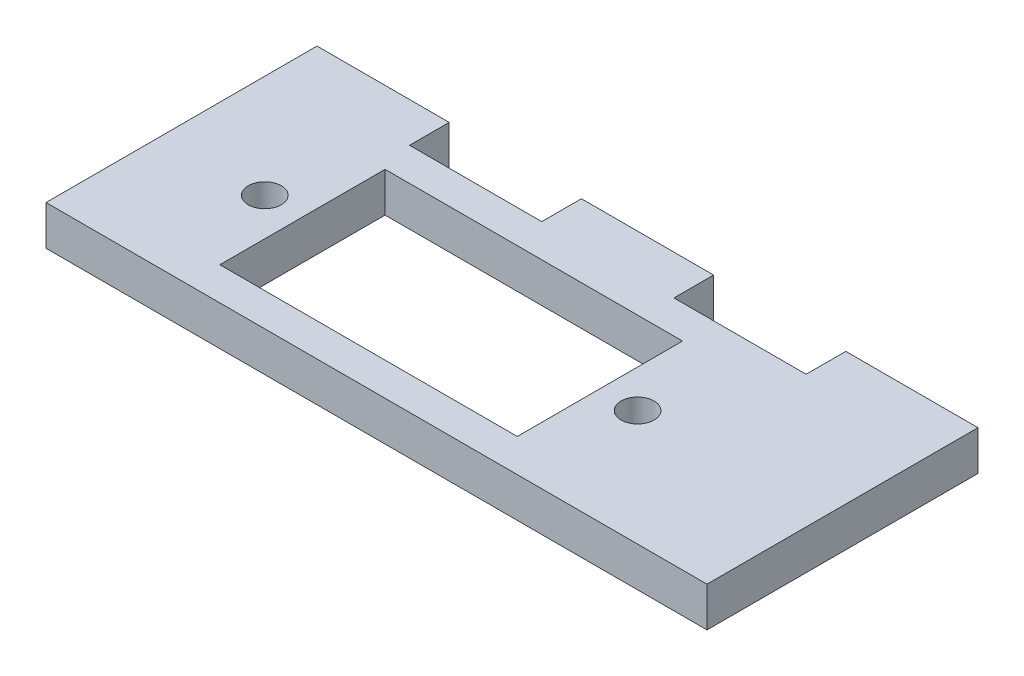
from build123d import *

# Parameters (mm, degrees)
CROQUIS1_R              = 1.25
CROQUIS1_W              = 22.5
CROQUIS1_H              = 12.5
CROQUIS1_W_2            = 10
CROQUIS1_H_2            = 3
SALIENTE_EXTRUIR1_DEPTH = 3


with BuildPart() as part:
    # Croquis1 → Saliente-Extruir1 (new body)
    # profile 1 of 4: a face of its own
    with BuildSketch(Plane(origin=(0, 0, 0), x_dir=(1, 0, 0), z_dir=(0, 1, 0))):
        Polygon((-25, 8.75), (-25, -8.75), (25, -8.75), (25, 8.75), (15, 8.75), (5, 8.75), (-5, 8.75), (-15, 8.75), align=None)
        with Locations(Location((-17.2, 0, 0), (0, 0, 270))):
            Circle(CROQUIS1_R, mode=Mode.SUBTRACT)
        with Locations((-3.1, 0)):
            Rectangle(CROQUIS1_W, CROQUIS1_H, mode=Mode.SUBTRACT)
        with Locations(Location((11, 0, 0), (0, 0, 270))):
            Circle(CROQUIS1_R, mode=Mode.SUBTRACT)
    # profile 2 of 4: a face of its own
    with BuildSketch(Plane(origin=(0, 0, 0), x_dir=(1, 0, 0), z_dir=(0, 1, 0))):
        with Locations((-20, 10.25)):
            Rectangle(CROQUIS1_W_2, CROQUIS1_H_2)
    # profile 3 of 4: a face of its own
    with BuildSketch(Plane(origin=(0, 0, 0), x_dir=(1, 0, 0), z_dir=(0, 1, 0))):
        with Locations((20, 10.25)):
            Rectangle(CROQUIS1_W_2, CROQUIS1_H_2)
    # profile 4 of 4: a face of its own
    with BuildSketch(Plane(origin=(0, 0, 0), x_dir=(1, 0, 0), z_dir=(0, 1, 0))):
        with Locations((0, 10.25)):
            Rectangle(CROQUIS1_W_2, CROQUIS1_H_2)
    extrude(amount=SALIENTE_EXTRUIR1_DEPTH)


solid = part.part
